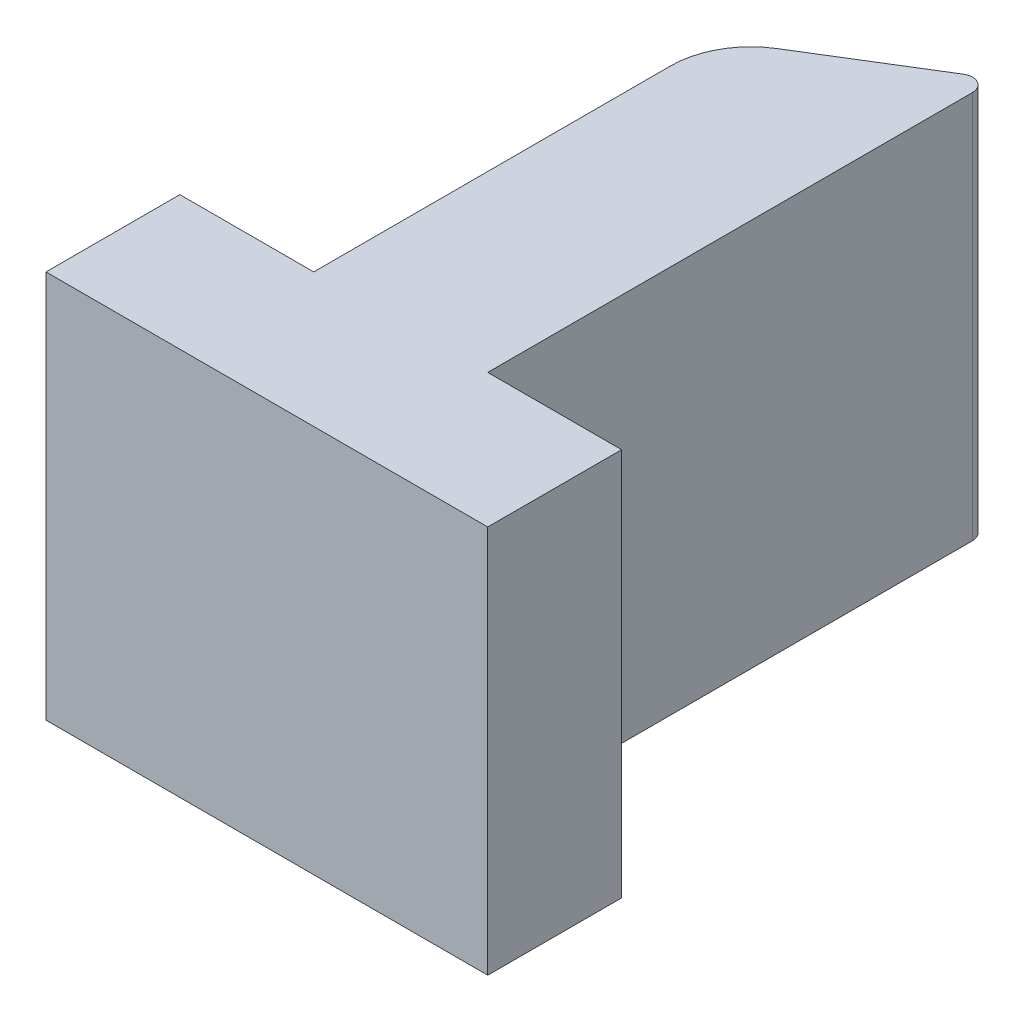
from build123d import *

# Parameters (mm, degrees)
EXTRUDE_1_DEPTH = 14.5
FILLET_1_R      = 3
FILLET_2_R      = 0.5


with BuildPart() as part:
    # 草图1 → 凸台-拉伸1 (new body)
    with BuildSketch(Plane(origin=(0, 0, 0), x_dir=(1, 0, 0), z_dir=(0, 1, 0))):
        Polygon((0, 0), (6.5, 4), (6.5, -15), (11.5, -15), (11.5, -20), (-5, -20), (-5, -15), (0, -15), align=None)
    extrude(amount=EXTRUDE_1_DEPTH)

    # 圆角1
    fillet_1_edges = [part.edges().sort_by_distance(p)[0] for p in [
        (0, 7.25, 0),
    ]]
    fillet(fillet_1_edges, radius=FILLET_1_R)

    # 圆角2
    fillet_2_edges = [part.edges().sort_by_distance(p)[0] for p in [
        (6.5, 7.25, -4),
    ]]
    fillet(fillet_2_edges, radius=FILLET_2_R)


solid = part.part
